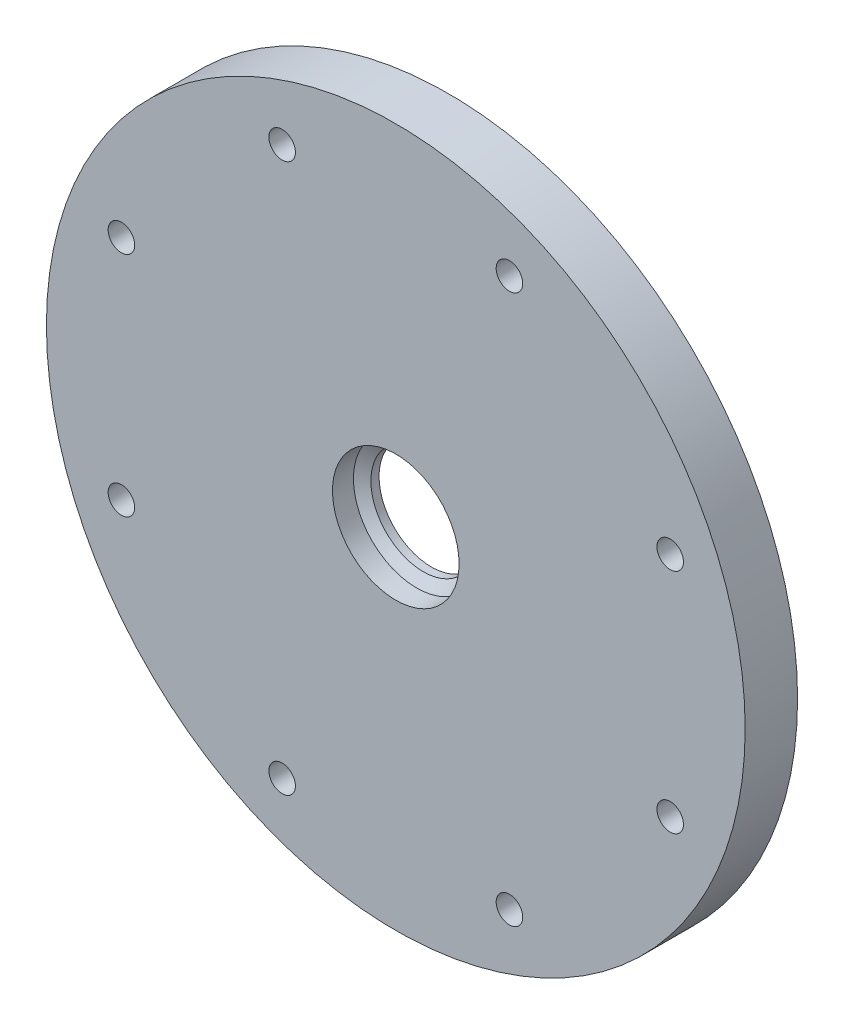
from build123d import *

# Parameters (mm, degrees)
SKETCH1_R                         = 63.5
SKETCH1_R_2                       = 9.525
BOSS_EXTRUDE1_DEPTH               = 9.525
SKETCH4_R                         = 2.413
CUT_EXTRUDE1_DEPTH                = 91.306287849
CIRPATTERN1_COUNT                 = 8
SKETCH7_R                         = 33.02
BOSS_EXTRUDE4_DEPTH               = 4.826
CUT_EXTRUDE2_START                = -3.048
SKETCH9_R                         = 33.02
CUT_EXTRUDE2_DEPTH                = 3.048
PIPE_TAP_DRILL_FOR_3_4_TAP4_D     = 23.0124
PIPE_TAP_DRILL_FOR_3_4_TAP4_DEPTH = 3.81
PIPE_TAP_DRILL_FOR_3_4_TAP4_TIP   = 6.913622455


with BuildPart() as part:
    # Sketch1 → Boss-Extrude1 (new body)
    with BuildSketch(Plane.XY):
        with Locations(Location((0, 0, 0), (0, 0, 180))):
            Circle(SKETCH1_R)
        with Locations(Location((0, 0, 0), (0, 0, 180))):
            Circle(SKETCH1_R_2, mode=Mode.SUBTRACT)
    extrude(amount=BOSS_EXTRUDE1_DEPTH)

    # Sketch4 → Cut-Extrude1 (cut, through all)
    with BuildSketch(Plane.XY.offset(9.525)):
        with Locations((49.866397767, 20.655338262)):
            Circle(SKETCH4_R)
    cut_extrude1 = extrude(amount=-CUT_EXTRUDE1_DEPTH, mode=Mode.SUBTRACT)

    # CirPattern1: Cut-Extrude1 ×8 about axis
    cirpattern1_axis = Axis((0, 0, 0), (0, 0, 1))
    for i in range(1, CIRPATTERN1_COUNT):
        add(cut_extrude1.rotate(cirpattern1_axis, i * 360 / CIRPATTERN1_COUNT), mode=Mode.SUBTRACT)

    # Sketch7 → Boss-Extrude4 (add)
    # profile 1 of 2: a face of its own
    with BuildSketch(Plane.XY):
        with BuildLine():
            ThreePointArc((44.898742199, 0), (44.018213285, 2.330669915), (41.72653773, 3.308205888))
            Line((41.72653773, 3.308205888), (38.377645632, 3.308205888))
            ThreePointArc((38.377645632, 3.308205888), (36.132581602, 2.378269918), (35.202645632, 0.133205888))
            ThreePointArc((35.202645632, 0.133205888), (34.829644744, -0.48063442), (34.295865632, 0))
            add(Edge.make_bspline(
                [(34.295865632, 0), (34.29882834, 0.071916436), (34.304754577, 0.21576926), (34.311966888, 0.431642324), (34.317934755, 0.647612083), (34.327139988, 1.079917114), (34.332942166, 2.090306576), (34.279898225, 3.607362054), (34.120445155, 5.41030125), (33.960201682, 6.560746683), (33.865422793, 7.135076209), (33.865142183, 7.136775827)],
                knots=[0, 0, 0, 0, 0.000870248, 0.001740737, 0.002611466, 0.003482435, 0.006968712, 0.014826916, 0.02182843, 0.028845498, 0.028866325, 0.028866325, 0.028866325, 0.028866325], degree=3))
            add(Edge.make_bspline(
                [(33.865142183, 7.136775827), (33.7706713, 7.708973751), (33.552478291, 8.851599937), (33.138997804, 10.54970943), (32.639140351, 12.230302519), (32.054174895, 13.887355713), (31.385187056, 15.516557503), (30.633483645, 17.113645751), (29.800589951, 18.674419055), (28.8882464, 20.194747988), (27.898404875, 21.670586138), (26.833224521, 23.097980967), (25.695067067, 24.473084443), (24.486491635, 25.79216345), (23.210249051, 27.051609932), (21.869275652, 28.247950753), (20.466686605, 29.377857252), (19.005768742, 30.438154464), (17.489972932, 31.425829986), (15.922906004, 32.338042467), (14.30832223, 33.172129685), (12.650114403, 33.925616212), (10.95230451, 34.596220626), (9.219034045, 35.18186226), (7.454553956, 35.680667464), (5.663214286, 36.090975363), (3.849453494, 36.411343101), (2.017787512, 36.640550541), (0.172798549, 36.777604421), (-1.680876324, 36.82174194), (-3.538556782, 36.772433779), (-5.395531021, 36.629386524), (-7.247067665, 36.392544506), (-9.088427776, 36.062091031), (-10.914876942, 35.638449008), (-12.721697408, 35.122280961), (-14.504200214, 34.514488429), (-16.257737325, 33.816210747), (-17.977713699, 33.028823219), (-19.659599284, 32.153934663), (-21.298940898, 31.193384362), (-22.891373965, 30.149238397), (-24.43263408, 29.02378539), (-25.918568367, 27.819531655), (-27.345146601, 26.539195761), (-28.708472073, 25.185702541), (-30.004792148, 23.762176529), (-31.230508517, 22.271934869), (-32.382187085, 20.718479685), (-33.456567491, 19.105489956), (-34.450572223, 17.436812889), (-35.361315302, 15.716454831), (-36.186110516, 13.948571725), (-36.92247918, 12.137459144), (-37.568157395, 10.287541924), (-38.121102788, 8.403363415), (-38.579500717, 6.489574383), (-38.941769921, 4.550921586), (-39.206567586, 2.592236057), (-39.372793836, 0.618421113), (-39.439595611, -1.36555987), (-39.406369933, -3.354695889), (-39.272766542, -5.343940927), (-39.038689903, -7.328226707), (-38.704300556, -9.302475561), (-38.270015827, -11.261613379), (-37.736509879, -13.200582609), (-37.104713104, -15.11435526), (-36.375810853, -16.997945903), (-35.551241515, -18.846424601), (-34.632693929, -20.654929769), (-33.622104149, -22.418680905), (-32.521651558, -24.132991168), (-31.333754343, -25.793279776), (-30.061064337, -27.395084183), (-28.706461239, -28.934071999), (-27.273046228, -30.406052641), (-25.764134977, -31.806988658), (-24.18325009, -33.133006716), (-22.534112978, -34.380408214), (-20.820635184, -35.545679488), (-19.046909189, -36.625501594), (-17.217198713, -37.616759627), (-15.335928538, -38.516551562), (-13.407673866, -39.322196576), (-11.437149261, -40.031242854), (-9.429197172, -40.641474829), (-7.388776087, -41.15091985), (-5.32094834, -41.557854256), (-3.230867597, -41.86080884), (-1.123766056, -42.058573678), (0.995058608, -42.150202316), (3.120256518, -42.135015304), (5.246439066, -42.01260305), (7.368192535, -41.782828005), (9.480091844, -41.445826152), (11.576714375, -41.002007803), (13.652653862, -40.452057696), (15.702534288, -39.796934391), (17.72102376, -39.037868953), (19.702848338, -38.176362944), (21.642805765, -37.214185701), (23.535779073, -36.153370925), (25.376750026, -34.996212572), (27.16081237, -33.745260064), (28.883184839, -32.403312824), (30.539223912, -30.973414146), (32.12443625, -29.458844418), (33.634490817, -27.863113704), (35.065230621, -26.189953715), (36.412684063, -24.44330917), (37.673075861, -22.62732858), (38.842837509, -20.746354475), (39.91861725, -18.804913085), (40.897289536, -16.807703518), (41.775963949, -14.759586443), (42.55199355, -12.665572318), (43.22298264, -10.530809183), (43.786793912, -8.360570051), (44.241554967, -6.16023993), (44.571284542, -4.028278167), (44.740560267, -2.440845712), (44.813728039, -1.50376068), (44.839477521, -1.128293226), (44.857032226, -0.846470241), (44.872782179, -0.564469795), (44.886887576, -0.282309503), (44.894790326, -0.094111086), (44.898742199, 0)],
                knots=[0.028866325, 0.028866325, 0.028866325, 0.028866325, 0.035878186, 0.042926556, 0.049990663, 0.057070561, 0.064166299, 0.071277925, 0.078405484, 0.085549018, 0.092708569, 0.099884178, 0.107075882, 0.11428372, 0.121507729, 0.128747942, 0.136004396, 0.143277124, 0.150566158, 0.157871532, 0.165193276, 0.172531421, 0.179885999, 0.187257038, 0.194644569, 0.202048619, 0.209469218, 0.216906393, 0.224360171, 0.23183058, 0.239317647, 0.246821397, 0.254341857, 0.261879053, 0.269433009, 0.277003751, 0.284591303, 0.292195691, 0.299816937, 0.307455067, 0.315110103, 0.32278207, 0.33047099, 0.338176886, 0.345899781, 0.353639698, 0.361396658, 0.369170685, 0.376961799, 0.384770023, 0.392595378, 0.400437886, 0.408297568, 0.416174444, 0.424068536, 0.431979864, 0.439908449, 0.447854312, 0.455817472, 0.463797949, 0.471795764, 0.479810937, 0.487843486, 0.495893432, 0.503960795, 0.512045592, 0.520147845, 0.52826757, 0.536404789, 0.544559519, 0.552731779, 0.560921587, 0.569128963, 0.577353925, 0.58559649, 0.593856678, 0.602134505, 0.610429991, 0.618743153, 0.627074009, 0.635422576, 0.643788872, 0.652172916, 0.660574723, 0.668994312, 0.677431699, 0.685886903, 0.69435994, 0.702850826, 0.71135958, 0.719886217, 0.728430756, 0.736993211, 0.745573601, 0.754171941, 0.762788249, 0.771422539, 0.78007483, 0.788745137, 0.797433476, 0.806139864, 0.814864316, 0.823606849, 0.832367479, 0.841146221, 0.849943091, 0.858758106, 0.86759128, 0.87644263, 0.885312171, 0.894199918, 0.903105888, 0.912030094, 0.920972554, 0.929933282, 0.938912294, 0.947909603, 0.956925227, 0.96595918, 0.975011476, 0.984082132, 0.992034027, 0.994308583, 0.995446291, 0.996584287, 0.997722571, 0.998861142, 1, 1, 1, 1], degree=3))
        make_face()
        Circle(SKETCH7_R, mode=Mode.SUBTRACT)
    # profile 2 of 2: a face of its own
    with BuildSketch(Plane.XY):
        with BuildLine():
            ThreePointArc((35.202645632, 0.133205888), (36.132581602, 2.378269918), (38.377645632, 3.308205888))
            ThreePointArc((38.377645632, 3.308205888), (35.418733874, 4.394308044), (33.865142183, 7.136775827))
            add(Edge.make_bspline(
                [(34.295865632, 0), (34.29882834, 0.071916436), (34.304754577, 0.21576926), (34.311966888, 0.431642324), (34.317934755, 0.647612083), (34.327139988, 1.079917114), (34.332942166, 2.090306576), (34.279898225, 3.607362054), (34.120445155, 5.41030125), (33.960201682, 6.560746683), (33.865422793, 7.135076209), (33.865142183, 7.136775827)],
                knots=[0, 0, 0, 0, 0.000870248, 0.001740737, 0.002611466, 0.003482435, 0.006968712, 0.014826916, 0.02182843, 0.028845498, 0.028866325, 0.028866325, 0.028866325, 0.028866325], degree=3))
            ThreePointArc((34.295865632, 0), (34.829644744, -0.48063442), (35.202645632, 0.133205888))
        make_face()
    extrude(amount=-BOSS_EXTRUDE4_DEPTH)

    # Sketch9 → Cut-Extrude2 (cut)
    with BuildSketch(Plane(origin=(0, 0, 0), x_dir=(-1, 0, 0), z_dir=(0, 0, -1)).offset(CUT_EXTRUDE2_START)):
        with Locations(Location((0, 0, 0), (0, 0, 180))):
            Circle(SKETCH9_R)
    extrude(amount=CUT_EXTRUDE2_DEPTH, mode=Mode.SUBTRACT)

    # Pipe Tap Drill for 3/4 Tap4
    with Locations(Plane.XY.offset(9.525)):
        with Locations((0, 0)):
            Hole(PIPE_TAP_DRILL_FOR_3_4_TAP4_D / 2, depth=PIPE_TAP_DRILL_FOR_3_4_TAP4_DEPTH)
            with Locations((0, 0, -(PIPE_TAP_DRILL_FOR_3_4_TAP4_DEPTH + PIPE_TAP_DRILL_FOR_3_4_TAP4_TIP / 2))):  # 118° drill point
                Cone(0, PIPE_TAP_DRILL_FOR_3_4_TAP4_D / 2, PIPE_TAP_DRILL_FOR_3_4_TAP4_TIP, mode=Mode.SUBTRACT)


solid = part.part
